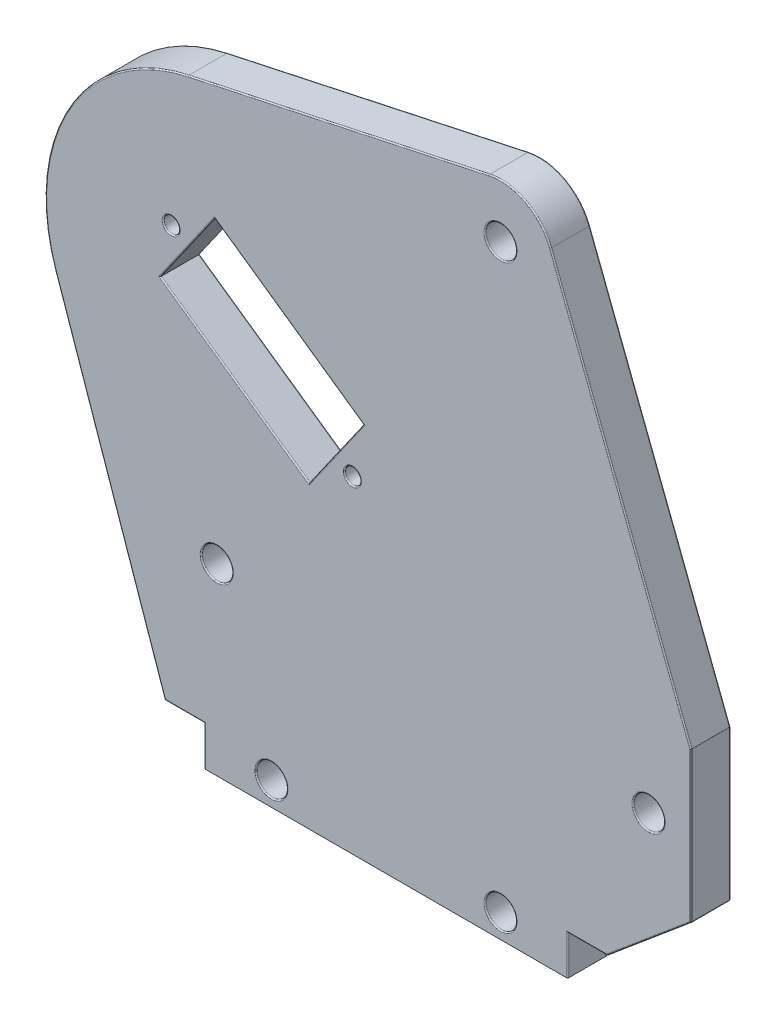
from build123d import *

# Parameters (mm, degrees)
SKETCH1_R                  = 1
BOSS_EXTRUDE1_DEPTH        = 5
M3_5_CLEARANCE_HOLE1_D     = 3.9
M3_5_CLEARANCE_HOLE1_DEPTH = 10
M3_5_CLEARANCE_HOLE1_TIP   = 1.171678207
FILLET1_R                  = 0.15
SKETCH4_W                  = 46
SKETCH4_H                  = 5
CUT_EXTRUDE4_DEPTH         = 10


with BuildPart() as part:
    # Sketch1 → Boss-Extrude1 (new body)
    with BuildSketch(Plane.XY):
        with BuildLine():
            Line((-23, 0), (23, 0))
            Line((23, 0), (23, 10))
            Line((23, 10), (28, 10))
            Line((28, 10), (38.609715537, 18.902608394))
            Line((38.609715537, 18.902608394), (38.609715537, 37.902608394))
            Line((38.609715537, 37.902608394), (20.834342221, 83.945446508))
            ThreePointArc((20.834342221, 83.945446508), (17.727021176, 87.474147163), (13.072325527, 88.138211024))
            Line((13.072325527, 88.138211024), (-25.029728066, 79.943634341))
            ThreePointArc((-25.029728066, 79.943634341), (-40.146654928, 68.813612437), (-41.843761624, 50.118193368))
            Line((-41.843761624, 50.118193368), (-28, 10))
            Line((-28, 10), (-23, 10))
            Line((-23, 10), (-23, 0))
        make_face()
        with Locations((-27.182792376, 62.455399709)):
            Circle(SKETCH1_R, mode=Mode.SUBTRACT)
        with Locations(Location((-4.246535136, 46.395259491, 0), (0, 0, 180))):
            Circle(SKETCH1_R, mode=Mode.SUBTRACT)
        Polygon((-21.693453648, 65.936370884), (-28.576370884, 56.106546352), (-9.735873865, 42.914288316), (-2.852956629, 52.744112848), align=None, mode=Mode.SUBTRACT)
    extrude(amount=BOSS_EXTRUDE1_DEPTH)

    # M3.5 Clearance Hole1
    with Locations(Plane.XY.offset(5)):
        with Locations((14.5, 81.5), (33.237803787, 28.254468489), (-21.412172308, 28.254468489), (-14.5, 8), (14.5, 8)):
            Hole(M3_5_CLEARANCE_HOLE1_D / 2, depth=M3_5_CLEARANCE_HOLE1_DEPTH)
            with Locations((0, 0, -(M3_5_CLEARANCE_HOLE1_DEPTH + M3_5_CLEARANCE_HOLE1_TIP / 2))):  # 118° drill point
                Cone(0, M3_5_CLEARANCE_HOLE1_D / 2, M3_5_CLEARANCE_HOLE1_TIP, mode=Mode.SUBTRACT)

    # Fillet1
    fillet1_edges = [part.edges().sort_by_distance(p)[0] for p in [
        (23, 5, 5),
        (-25.5, 10, 0),
        (-34.921880812, 30.059096684, 0),
        (-40.146654928, 68.813612437, 0),
        (-5.978701269, 84.040922682, 0),
        (17.727021176, 87.474147163, 0),
        (29.722028879, 60.924027451, 0),
        (25.5, 10, 5),
        (38.609715537, 28.402608394, 0),
        (33.304857769, 14.451304197, 0),
        (25.5, 10, 0),
        (23, 5, 0),
        (0, 0, 0),
        (-23, 5, 0),
        (33.304857769, 14.451304197, 5),
        (38.609715537, 28.402608394, 5),
        (-28, 10, 2.5),
        (38.609715537, 37.902608394, 2.5),
        (38.609715537, 18.902608394, 2.5),
        (28, 10, 2.5),
        (23, 0, 2.5),
        (-23, 0, 2.5),
        (29.722028879, 60.924027451, 5),
        (17.727021176, 87.474147163, 5),
        (-5.978701269, 84.040922682, 5),
        (-40.146654928, 68.813612437, 5),
        (-12.273205138, 59.340241866, 0),
        (-25.134912266, 61.021458618, 0),
        (-19.156122375, 49.510417334, 0),
        (-6.294415247, 47.829200582, 0),
        (-34.921880812, 30.059096684, 5),
        (-12.273205138, 59.340241866, 5),
        (-25.134912266, 61.021458618, 5),
        (-19.156122375, 49.510417334, 5),
        (-6.294415247, 47.829200582, 5),
        (-25.5, 10, 5),
        (-23, 5, 5),
        (-28.182792376, 62.455399709, 0),
        (-28.182792376, 62.455399709, 5),
        (-3.246535136, 46.395259491, 0),
        (-3.246535136, 46.395259491, 5),
        (16.45, 8, 0),
        (16.45, 8, 5),
        (-12.55, 8, 0),
        (-12.55, 8, 5),
        (-19.462172308, 28.254468489, 0),
        (0, 0, 5),
        (-19.462172308, 28.254468489, 5),
        (35.187803787, 28.254468489, 0),
        (35.187803787, 28.254468489, 5),
        (16.45, 81.5, 0),
        (16.45, 81.5, 5),
    ]]
    fillet(fillet1_edges, radius=FILLET1_R)

    # Sketch4 → Cut-Extrude4 (cut)
    with BuildSketch(Plane.XY.offset(5)):
        with Locations((0, 2.5)):
            Rectangle(SKETCH4_W, SKETCH4_H)
    extrude(amount=-CUT_EXTRUDE4_DEPTH, mode=Mode.SUBTRACT)


solid = part.part
